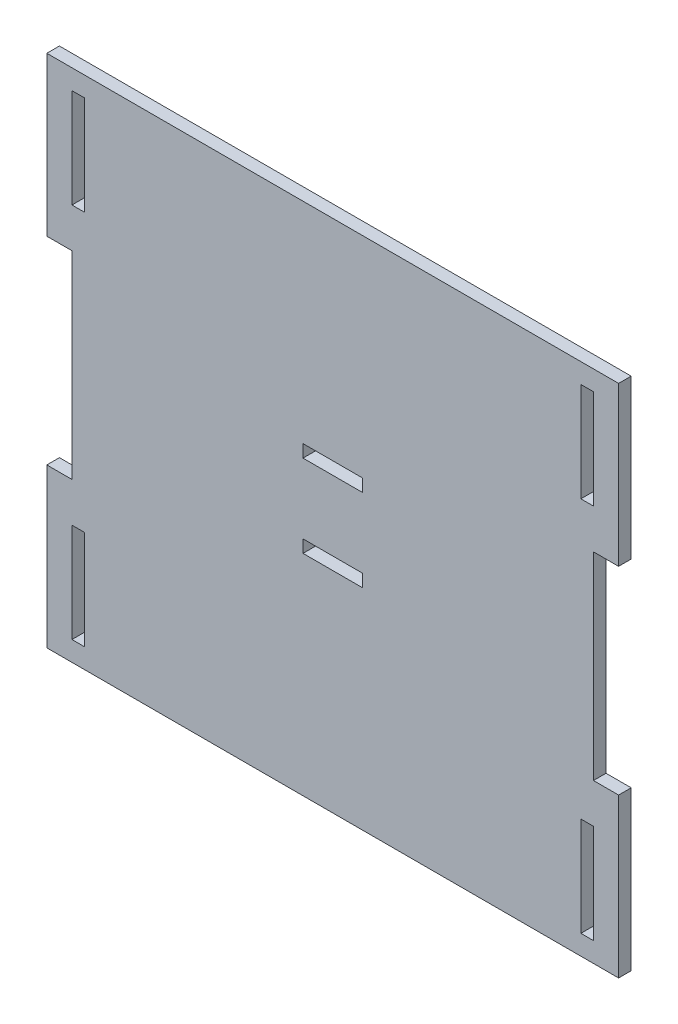
from build123d import *

# Parameters (mm, degrees)
SKETCH1_W           = 3.175
SKETCH1_H           = 25
SKETCH1_W_2         = 15
SKETCH1_H_2         = 3.175
BOSS_EXTRUDE1_DEPTH = 3.175


with BuildPart() as part:
    # Sketch1 → Boss-Extrude1 (new body)
    with BuildSketch(Plane.XY):
        Polygon((0, 90), (6.35, 90), (6.35, 40), (0, 40), (0, 0), (144.35, 0), (144.35, 40), (138, 40), (138, 90), (144.35, 90), (144.35, 130), (0, 130), align=None)
        with Locations((7.9375, 112.5)):
            Rectangle(SKETCH1_W, SKETCH1_H, mode=Mode.SUBTRACT)
        with Locations((136.4125, 112.5)):
            Rectangle(SKETCH1_W, SKETCH1_H, mode=Mode.SUBTRACT)
        with Locations((7.9375, 17.5)):
            Rectangle(SKETCH1_W, SKETCH1_H, mode=Mode.SUBTRACT)
        with Locations((136.4125, 17.5)):
            Rectangle(SKETCH1_W, SKETCH1_H, mode=Mode.SUBTRACT)
        with Locations((72.175, 54.5875)):
            Rectangle(SKETCH1_W_2, SKETCH1_H_2, mode=Mode.SUBTRACT)
        with Locations((72.175, 75.4125)):
            Rectangle(SKETCH1_W_2, SKETCH1_H_2, mode=Mode.SUBTRACT)
    extrude(amount=BOSS_EXTRUDE1_DEPTH)


solid = part.part
